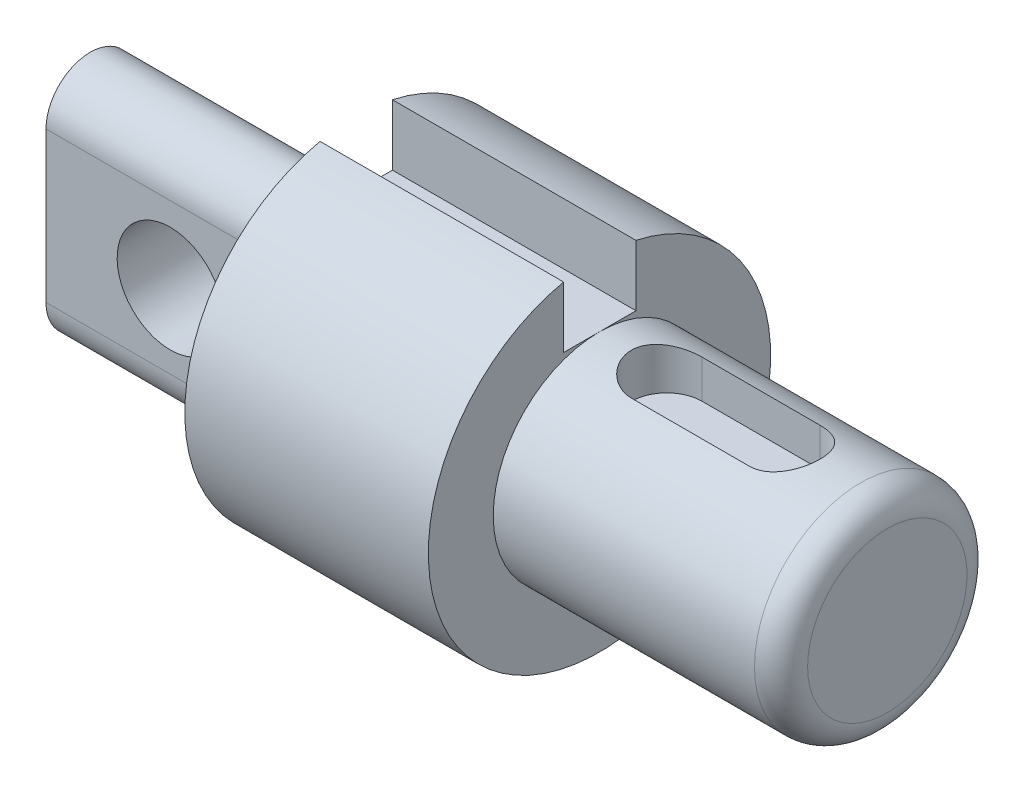
from build123d import *

# Parameters (mm, degrees)
FILLET1_R           = 6
CUT_EXTRUDE8_DEPTH  = 10
SKETCH6_W           = 55
SKETCH6_H           = 16.343735742
CUT_EXTRUDE15_DEPTH = 20
SKETCH7_R           = 5.198582593
CUT_EXTRUDE16_DEPTH = 10
BOSS_EXTRUDE1_DEPTH = 60
SKETCH9_R           = 12
CUT_EXTRUDE17_DEPTH = 60


with BuildPart() as part:
    # Sketch1 → Revolve1 (revolve)
    with BuildSketch(Plane.XY, mode=Mode.PRIVATE) as revolve1_sk:
        Polygon((0, 0), (0, 14.656862745), (55, 14.656862745), (55, 0), (120, 0), (120, -24), (0, -24), align=None)
    revolve(revolve1_sk.sketch.rotate(Axis((-5.281550193, -24, 0), (1, 0, 0)), 90), axis=Axis((-5.281550193, -24, 0), (1, 0, 0)))

    # Fillet1
    fillet1_edges = [part.edges().sort_by_distance(p)[0] for p in [
        (120, -24, -24),
    ]]
    fillet(fillet1_edges, radius=FILLET1_R)

    # Sketch2 → Cut-Extrude8 (cut)
    with BuildSketch(Plane(origin=(0, 0, 0), x_dir=(1, 0, 0), z_dir=(0, 1, 0))):
        with BuildLine():
            Line((70.195378011, 8), (96.812319076, 8))
            ThreePointArc((96.812319076, 8), (104.812319076, 0), (96.812319076, -8))
            Line((96.812319076, -8), (70.195378011, -8))
            ThreePointArc((70.195378011, -8), (62.195378011, 0), (70.195378011, 8))
        make_face()
    extrude(amount=-CUT_EXTRUDE8_DEPTH, mode=Mode.SUBTRACT)

    # Sketch6 → Cut-Extrude15 (cut)
    with BuildSketch(Plane(origin=(0, 0, 0), x_dir=(1, 0, 0), z_dir=(0, 1, 0))):
        with Locations((27.5, 0.064856094)):
            Rectangle(SKETCH6_W, SKETCH6_H)
    extrude(amount=CUT_EXTRUDE15_DEPTH, mode=Mode.SUBTRACT)

    # Sketch7 → Cut-Extrude16 (cut)
    with BuildSketch(Plane(origin=(0, 0, 0), x_dir=(1, 0, 0), z_dir=(0, 1, 0))):
        with Locations(Location((27.964324109, 0, 0), (0, 0, 270))):
            Circle(SKETCH7_R)
    extrude(amount=-CUT_EXTRUDE16_DEPTH, mode=Mode.SUBTRACT)

    # Sketch8 → Boss-Extrude1 (add)
    with BuildSketch(Plane.ZY):
        with BuildLine():
            Line((10, -12.82210563), (10, -46.757053375))
            ThreePointArc((10, -46.757053375), (0, -56.757053375), (-10, -46.757053375))
            Line((-10, -46.757053375), (-10, -12.82210563))
            ThreePointArc((-10, -12.82210563), (0, -2.82210563), (10, -12.82210563))
        make_face()
    extrude(amount=BOSS_EXTRUDE1_DEPTH)

    # Sketch9 → Cut-Extrude17 (cut)
    with BuildSketch(Plane(origin=(0, 0, -10), x_dir=(-1, 0, 0), z_dir=(0, 0, -1))):
        with Locations(Location((31.933586772, -30.014179295, 0), (0, 0, 90))):
            Circle(SKETCH9_R)
    extrude(amount=-CUT_EXTRUDE17_DEPTH, mode=Mode.SUBTRACT)


solid = part.part
